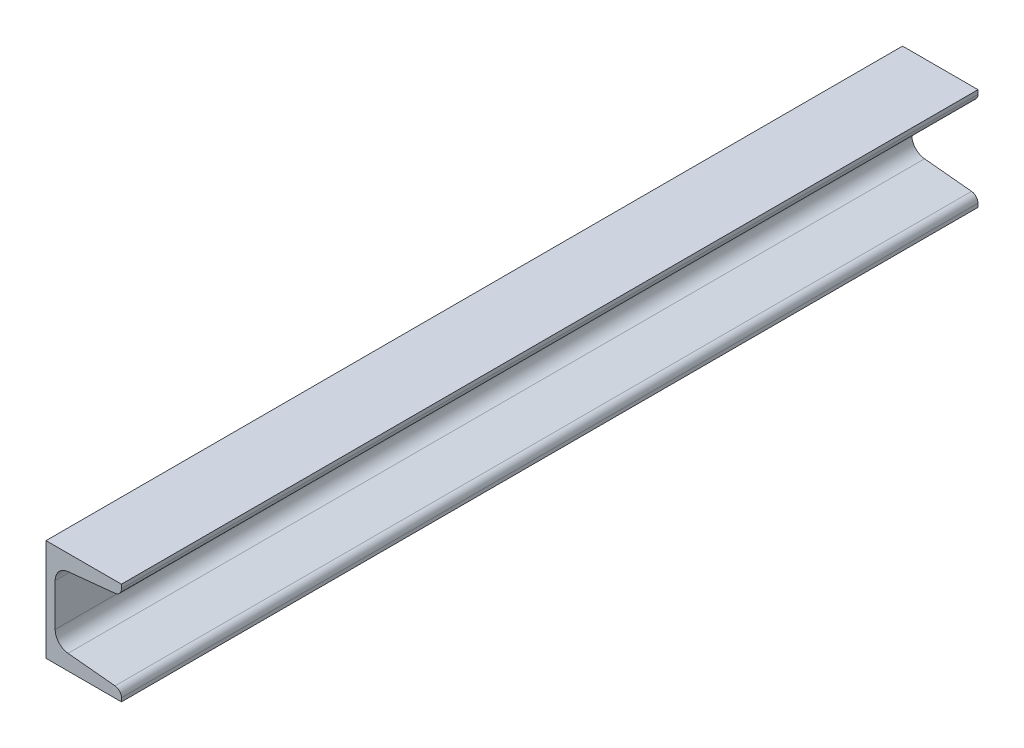
from build123d import *

# Parameters (mm, degrees)
EXTRUDE_1_DEPTH = 420


with BuildPart() as part:
    # 草图1 → 凸台-拉伸1 (new body)
    with BuildSketch(Plane.XY):
        with BuildLine():
            Line((0, 0), (0, 50))
            Line((0, 50), (37, 50))
            Line((37, 50), (37, 48.040012398))
            ThreePointArc((37, 48.040012398), (36.095083867, 45.691493776), (33.848263017, 44.557382233))
            Line((33.848263017, 44.557382233), (10.803473967, 42.252903328))
            ThreePointArc((10.803473967, 42.252903328), (6.309832265, 39.984680242), (4.5, 35.287642996))
            Line((4.5, 35.287642996), (4.5, 14.509912935))
            ThreePointArc((4.5, 14.509912935), (6.309832265, 9.812875689), (10.803473967, 7.544652603))
            Line((10.803473967, 7.544652603), (33.848263017, 5.240173698))
            ThreePointArc((33.848263017, 5.240173698), (36.095083867, 4.106062155), (37, 1.757543533))
            Line((37, 1.757543533), (37, 0))
            Line((37, 0), (0, 0))
        make_face()
    extrude(amount=EXTRUDE_1_DEPTH)


solid = part.part
